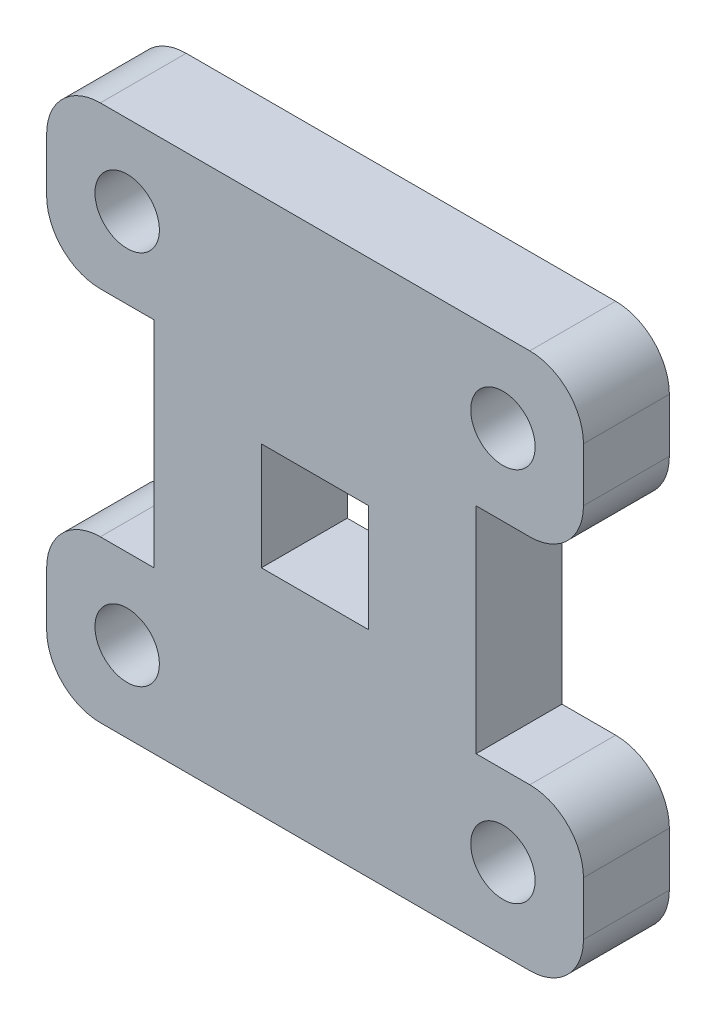
from build123d import *

# Parameters (mm, degrees)
SKETCH1_R           = 6
SKETCH1_W           = 20
SKETCH1_H           = 20
BOSS_EXTRUDE1_DEPTH = 16


with BuildPart() as part:
    # Sketch1 → Boss-Extrude1 (new body)
    with BuildSketch(Plane.XY):
        with BuildLine():
            Line((-40, 20), (-30, 20))
            Line((-30, 20), (-30, -20))
            Line((-30, -20), (-40, -20))
            ThreePointArc((-40, -20), (-47.071067812, -22.928932188), (-50, -30))
            Line((-50, -30), (-50, -40))
            ThreePointArc((-50, -40), (-47.071067812, -47.071067812), (-40, -50))
            Line((-40, -50), (40, -50))
            ThreePointArc((40, -50), (47.071067812, -47.071067812), (50, -40))
            Line((50, -40), (50, -30))
            ThreePointArc((50, -30), (47.071067812, -22.928932188), (40, -20))
            Line((40, -20), (30, -20))
            Line((30, -20), (30, 20))
            Line((30, 20), (40, 20))
            ThreePointArc((40, 20), (47.071067812, 22.928932188), (50, 30))
            Line((50, 30), (50, 40))
            ThreePointArc((50, 40), (47.071067812, 47.071067812), (40, 50))
            Line((40, 50), (-40, 50))
            ThreePointArc((-40, 50), (-47.071067812, 47.071067812), (-50, 40))
            Line((-50, 40), (-50, 30))
            ThreePointArc((-50, 30), (-47.071067812, 22.928932188), (-40, 20))
        make_face()
        with Locations((35, 35)):
            Circle(SKETCH1_R, mode=Mode.SUBTRACT)
        with Locations(Location((-35, 35, 0), (0, 0, 180))):
            Circle(SKETCH1_R, mode=Mode.SUBTRACT)
        with Locations(Location((35, -35, 0), (0, 0, 180))):
            Circle(SKETCH1_R, mode=Mode.SUBTRACT)
        with Locations((-35, -35)):
            Circle(SKETCH1_R, mode=Mode.SUBTRACT)
        Rectangle(SKETCH1_W, SKETCH1_H, mode=Mode.SUBTRACT)
    extrude(amount=BOSS_EXTRUDE1_DEPTH)


solid = part.part
